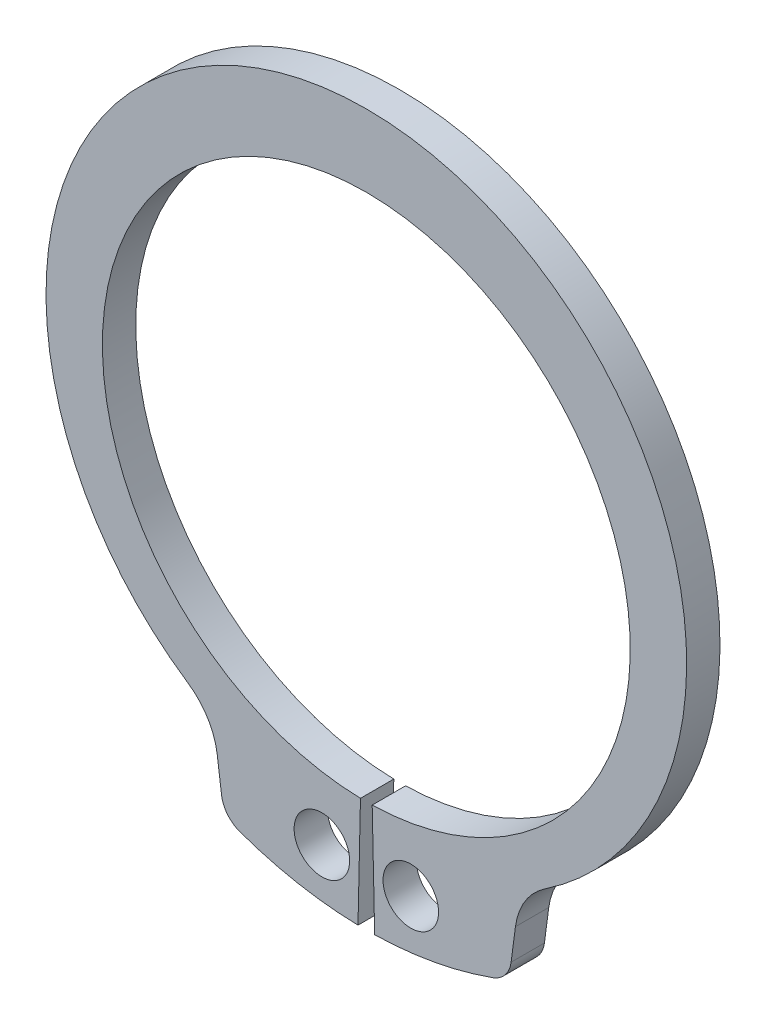
from build123d import *

# Parameters (mm, degrees)
BODYSKE_R  = 1
BODY_DEPTH = 1.2


with BuildPart() as part:
    # BodySke → Body (new body)
    with BuildSketch(Plane.XY):
        with BuildLine():
            Line((0.211111111, -9.497654031), (0.3, -13.496666255))
            ThreePointArc((0.3, -13.496666255), (2.460328137, -13.273913721), (4.556982895, -12.707631836))
            ThreePointArc((4.556982895, -12.707631836), (4.997824833, -12.394099074), (5.210873468, -11.896851967))
            Line((5.210873468, -11.896851967), (5.367047697, -10.710590926))
            ThreePointArc((5.367047697, -10.710590926), (5.712651137, -9.743091769), (6.425965969, -9.003714798))
            ThreePointArc((6.425965969, -9.003714798), (0, 12.1), (-6.425965969, -9.003714798))
            ThreePointArc((-6.425965969, -9.003714798), (-5.712651137, -9.743091769), (-5.367047697, -10.710590926))
            Line((-5.367047697, -10.710590926), (-5.210873468, -11.896851967))
            ThreePointArc((-5.210873468, -11.896851967), (-4.997824833, -12.394099074), (-4.556982895, -12.707631836))
            ThreePointArc((-4.556982895, -12.707631836), (-2.460328137, -13.273913721), (-0.3, -13.496666255))
            Line((-0.3, -13.496666255), (-0.211111111, -9.497654031))
            ThreePointArc((-0.211111111, -9.497654031), (0, 9.5), (0.211111111, -9.497654031))
        make_face()
        with Locations((1.6, -11.640554111)):
            Circle(BODYSKE_R, mode=Mode.SUBTRACT)
        with Locations((-1.6, -11.640554111)):
            Circle(BODYSKE_R, mode=Mode.SUBTRACT)
    extrude(amount=-BODY_DEPTH)


solid = part.part
